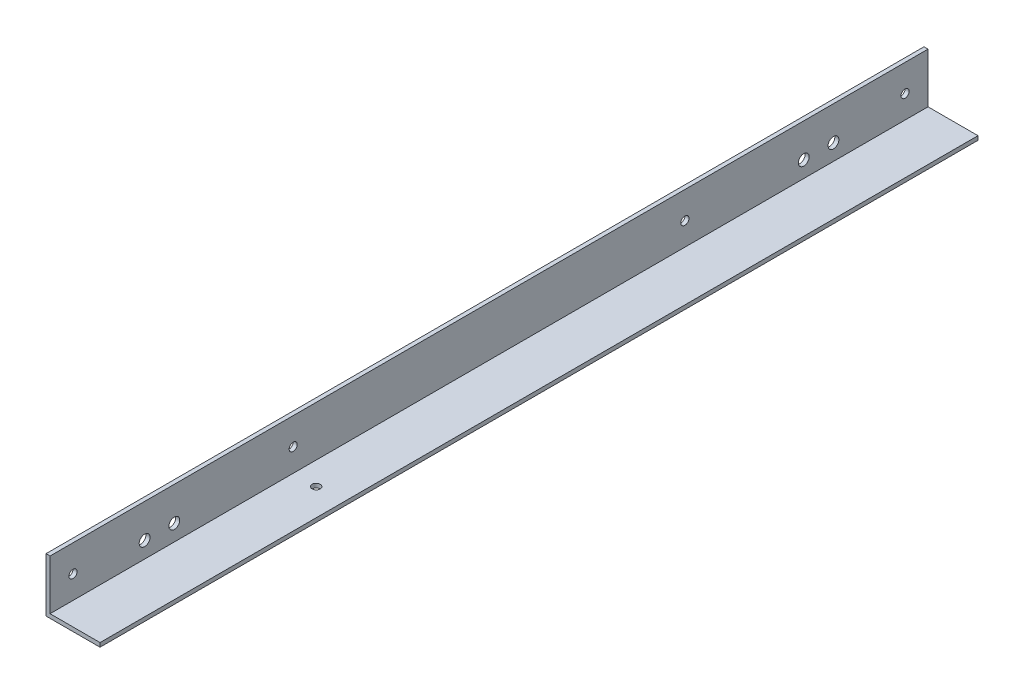
from build123d import *

# Parameters (mm, degrees)
EXTRUSION1_DEPTH = 325
ESQUISSE3_R      = 1.5
ESQUISSE3_R_2    = 2
EXTRUSION3_DEPTH = 300
ESQUISSE4_R      = 1.5
EXTRUSION5_DEPTH = 10


with BuildPart() as part:
    # Esquisse1 → Extrusion1 (new body)
    with BuildSketch(Plane.XY):
        Polygon((-17.43168638, 4.773368421), (-17.43168638, -15.226631579), (2.56831362, -15.226631579), (2.56831362, -13.726631579), (-15.93168638, -13.726631579), (-15.93168638, 4.773368421), align=None)
    extrude(amount=EXTRUSION1_DEPTH)

    # Esquisse3 → Extrusion3 (cut)
    with BuildSketch(Plane(origin=(-15.93168638, 0, 0), x_dir=(0, 0, -1), z_dir=(1, 0, 0))):
        with Locations((-316.5, -5.226631579)):
            Circle(ESQUISSE3_R)
        with Locations((-8.5, -5.226631579)):
            Circle(ESQUISSE3_R)
        with Locations((-35, -7.726631579)):
            Circle(ESQUISSE3_R_2)
        with Locations((-46, -7.726631579)):
            Circle(ESQUISSE3_R_2)
        with Locations((-290, -7.726631579)):
            Circle(ESQUISSE3_R_2)
        with Locations((-279, -7.726631579)):
            Circle(ESQUISSE3_R_2)
        with Locations((-235, -5.226631579)):
            Circle(ESQUISSE3_R)
        with Locations((-90, -5.226631579)):
            Circle(ESQUISSE3_R)
    extrude(amount=-EXTRUSION3_DEPTH, mode=Mode.SUBTRACT)

    # Esquisse4 → Extrusion5 (cut)
    with BuildSketch(Plane.XZ.offset(15.226631579)):
        with Locations(Location((-7.43168638, 235, 0), (0, 0, 270))):
            Circle(ESQUISSE4_R)
    extrude(amount=-EXTRUSION5_DEPTH, mode=Mode.SUBTRACT)


solid = part.part
